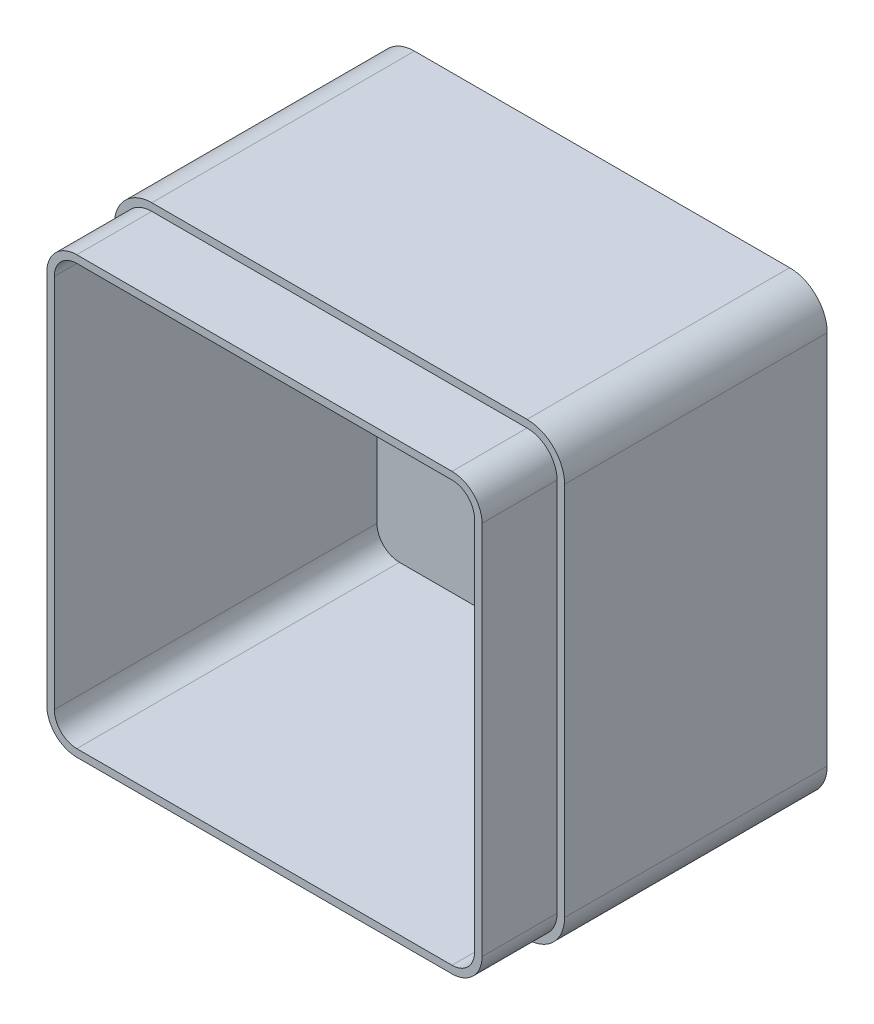
from build123d import *

# Parameters (mm, degrees)
ESQUISSE1_W             = 120
ESQUISSE1_H             = 120
BOSS_EXTRU_1_DEPTH      = 90
CONG_1_R                = 10
COQUE2_T                = -4
ENL_V_MAT_EXTRU_2_DEPTH = 20


with BuildPart() as part:
    # Esquisse1 → Boss.-Extru.1 (new body)
    with BuildSketch(Plane.XY):
        with Locations((-60, -60)):
            Rectangle(ESQUISSE1_W, ESQUISSE1_H)
    extrude(amount=BOSS_EXTRU_1_DEPTH)

    # Congé1
    cong_1_edges = [part.edges().sort_by_distance(p)[0] for p in [
        (0, -120, 45),
        (-120, -120, 45),
        (-120, 0, 45),
        (0, 0, 45),
    ]]
    fillet(cong_1_edges, radius=CONG_1_R)

    # Coque2
    coque2_openings = [part.faces().sort_by_distance(p)[0] for p in [
        (-60, -60, 90),
    ]]
    offset(amount=COQUE2_T, openings=coque2_openings, kind=Kind.INTERSECTION)

    # Esquisse5 → Enlèv. mat.-Extru.2 (cut)
    with BuildSketch(Plane.XY.offset(90)):
        with BuildLine():
            Line((-120, -10), (-120, -110))
            ThreePointArc((-120, -110), (-117.071067812, -117.071067812), (-110, -120))
            Line((-110, -120), (-10, -120))
            ThreePointArc((-10, -120), (-2.928932188, -117.071067812), (0, -110))
            Line((0, -110), (0, -10))
            ThreePointArc((0, -10), (-2.928932188, -2.928932188), (-10, 0))
            Line((-10, 0), (-110, 0))
            ThreePointArc((-110, 0), (-117.071067812, -2.928932188), (-120, -10))
        make_face()
        with BuildLine():
            Line((-118, -10), (-118, -110))
            ThreePointArc((-118, -110), (-115.656854249, -115.656854249), (-110, -118))
            Line((-110, -118), (-10, -118))
            ThreePointArc((-10, -118), (-4.343145751, -115.656854249), (-2, -110))
            Line((-2, -110), (-2, -10))
            ThreePointArc((-2, -10), (-4.343145751, -4.343145751), (-10, -2))
            Line((-10, -2), (-110, -2))
            ThreePointArc((-110, -2), (-115.656854249, -4.343145751), (-118, -10))
        make_face(mode=Mode.SUBTRACT)
    extrude(amount=-ENL_V_MAT_EXTRU_2_DEPTH, mode=Mode.SUBTRACT)


solid = part.part
